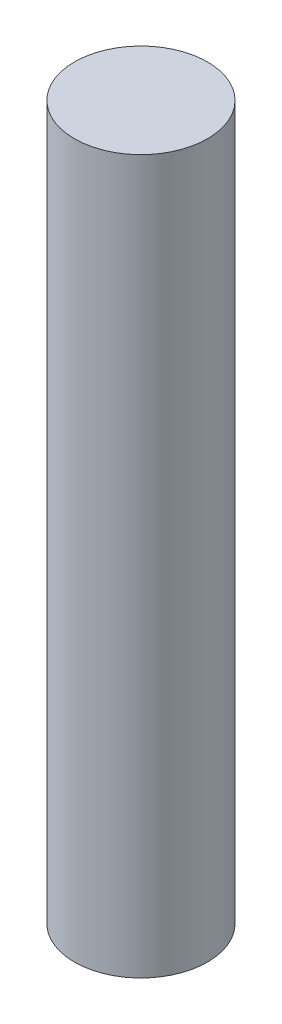
from build123d import *

# Parameters (mm, degrees)
SKETCH1_R           = 10.668
BOSS_EXTRUDE1_DEPTH = 114.3


with BuildPart() as part:
    # Sketch1 → Boss-Extrude1 (new body)
    with BuildSketch(Plane(origin=(0, 0, 0), x_dir=(1, 0, 0), z_dir=(0, 1, 0))):
        with Locations(Location((0, 0, 0), (0, 0, 270))):
            Circle(SKETCH1_R)
    extrude(amount=BOSS_EXTRUDE1_DEPTH)


solid = part.part
